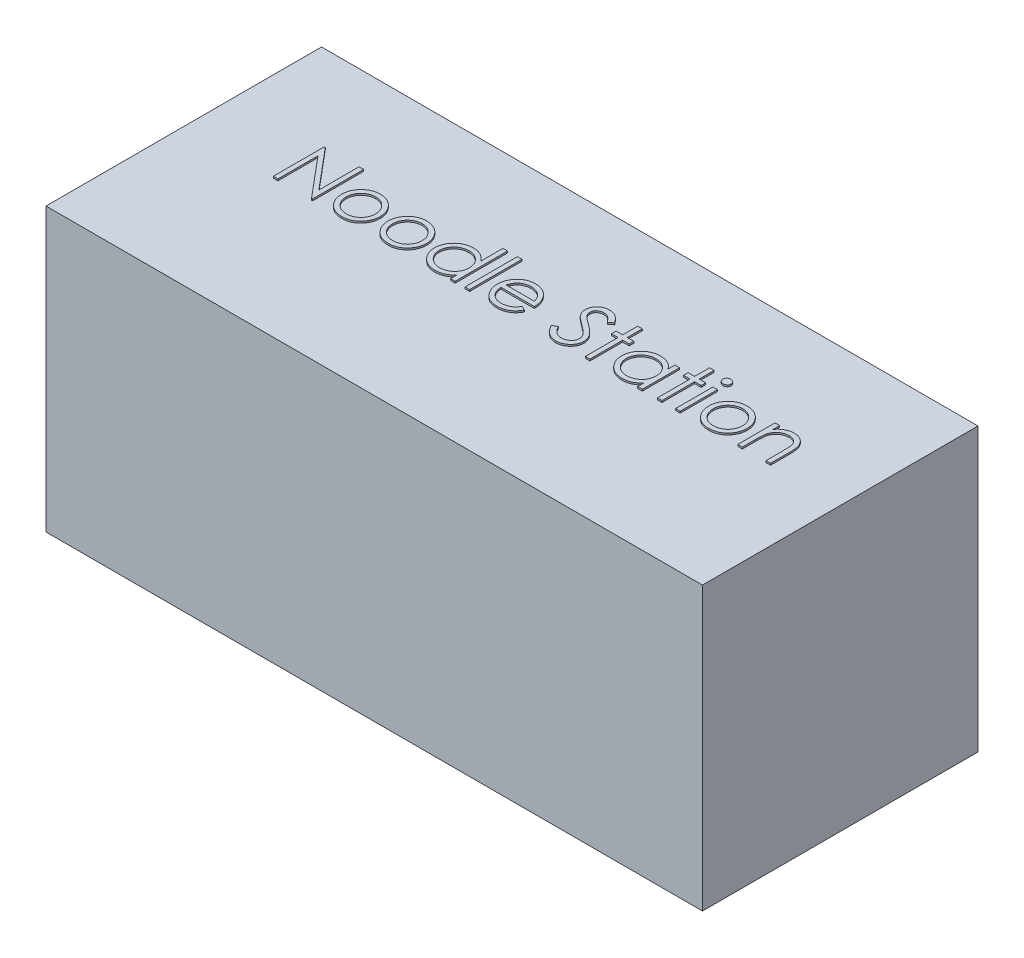
from build123d import *

# Parameters (mm, degrees)
SKETCH1_W           = 1930
SKETCH1_H           = 810
BOSS_EXTRUDE1_DEPTH = 830
SKETCH2_W           = 13.461538461
SKETCH2_H           = 153.846153846
SKETCH2_H_2         = 109.615384615
BOSS_EXTRUDE2_DEPTH = 5


with BuildPart() as part:
    # Sketch1 → Boss-Extrude1 (new body)
    with BuildSketch(Plane(origin=(0, 0, 0), x_dir=(1, 0, 0), z_dir=(0, 1, 0))):
        Rectangle(SKETCH1_W, SKETCH1_H)
    extrude(amount=BOSS_EXTRUDE1_DEPTH)

    # Sketch2 → Boss-Extrude2 (add)
    # profile 1 of 14: a face of its own
    with BuildSketch(Plane(origin=(0, 830, 0), x_dir=(1, 0, 0), z_dir=(0, 1, 0))):
        Polygon((-701.623137804, 0), (-701.623137804, 150), (-698.798618573, 150), (-599.700060881, 31.941105769), (-599.700060881, 150), (-586.238522419, 150), (-586.238522419, 0), (-589.303426265, 0), (-688.161599342, 117.788461538), (-688.161599342, 0), align=None)
    # profile 2 of 14: a face of its own
    with BuildSketch(Plane(origin=(0, 830, 0), x_dir=(1, 0, 0), z_dir=(0, 1, 0))):
        with BuildLine():
            add(Edge.make_bspline(
                [(-498.678426265, 111.538461538), (-496.621657429, 111.494666204), (-492.58883639, 111.408794256), (-486.682784138, 110.491010014), (-481.045135456, 109.08755154), (-475.654298648, 107.147341737), (-470.579314558, 104.546686713), (-465.746261239, 101.443431379), (-461.168389429, 97.767034512), (-458.424545318, 94.923117296), (-457.03179165, 93.479567308)],
                knots=[0, 0, 0, 0, 1.054011418, 2.066658804, 3.057071809, 4.030435133, 4.997543892, 5.974964718, 6.972108034, 8, 8, 8, 8], degree=3))
            add(Edge.make_bspline(
                [(-457.03179165, 93.479567308), (-455.832565047, 92.098967917), (-453.45732018, 89.364487536), (-450.411646517, 84.930675552), (-447.787865368, 80.338956955), (-445.68516704, 75.528357241), (-444.027237453, 70.540871334), (-442.850136185, 65.35935657), (-442.149981831, 59.995255977), (-442.055568962, 56.352234346), (-442.007753188, 54.507211538)],
                knots=[0, 0, 0, 0, 1.025258237, 2.030674902, 3.01204498, 3.988269485, 4.97094183, 5.956517959, 6.965070386, 8, 8, 8, 8], degree=3))
            add(Edge.make_bspline(
                [(-442.007753188, 54.507211538), (-442.049810502, 52.651494781), (-442.132917715, 48.984511924), (-442.919072703, 43.583681962), (-444.141833527, 38.34676099), (-445.891769449, 33.295674114), (-448.135688417, 28.414981511), (-450.87386074, 23.726000827), (-454.125501475, 19.21948083), (-457.81138705, 14.933687762), (-461.885038885, 10.983707128), (-466.304302385, 7.541067004), (-470.982332403, 4.591573103), (-475.981333257, 2.215726719), (-481.255654122, 0.342453849), (-486.816671326, -0.973261141), (-492.655745768, -1.768761874), (-496.642626684, -1.870915014), (-498.678426265, -1.923076923)],
                knots=[0, 0, 0, 0, 0.998656419, 1.973391657, 2.932242238, 3.890759089, 4.846373663, 5.82037756, 6.809684879, 7.83454468, 8.860553229, 9.859544525, 10.845671541, 11.83227036, 12.833544569, 13.85385346, 14.904124723, 16, 16, 16, 16], degree=3))
            add(Edge.make_bspline(
                [(-498.678426265, -1.923076923), (-500.724199959, -1.870739942), (-504.73095109, -1.768235321), (-510.590636029, -0.976351776), (-516.161619698, 0.341847477), (-521.442845349, 2.22188288), (-526.46333879, 4.591649041), (-531.168474373, 7.532150022), (-535.591327895, 10.984728104), (-539.665841513, 14.93341112), (-543.351496027, 19.219552106), (-546.603196385, 23.725982327), (-549.34135322, 28.414986332), (-551.585276243, 33.295672829), (-553.335211083, 38.346761334), (-554.557972197, 43.583681868), (-555.344127107, 48.984511948), (-555.427234331, 52.651494789), (-555.46929165, 54.507211538)],
                knots=[0, 0, 0, 0, 1.099876186, 2.154163076, 3.173186993, 4.173200201, 5.163417411, 6.152872554, 7.150605724, 8.17532212, 9.198891216, 10.186952605, 11.159729845, 12.11414092, 13.071450619, 14.029093627, 15.002601286, 16, 16, 16, 16], degree=3))
            add(Edge.make_bspline(
                [(-555.46929165, 54.507211538), (-555.421149778, 56.342206362), (-555.325837144, 59.975180751), (-554.626386755, 65.329197636), (-553.453877192, 70.501942882), (-551.793960201, 75.470177567), (-549.671880591, 80.259696255), (-547.084968251, 84.86276044), (-544.008226856, 89.276523317), (-541.642428933, 92.007469604), (-540.445253188, 93.389423077)],
                knots=[0, 0, 0, 0, 1.031353054, 2.041901799, 3.029428768, 4.008703097, 4.981709435, 5.96992636, 6.972712378, 8, 8, 8, 8], degree=3))
            add(Edge.make_bspline(
                [(-540.445253188, 93.389423077), (-539.054599287, 94.845491902), (-536.319633694, 97.709107454), (-531.718973934, 101.374787058), (-526.897810172, 104.542618795), (-521.766741909, 107.091599457), (-516.380333711, 109.098964502), (-510.713794745, 110.494629436), (-504.787701226, 111.405487506), (-500.735146036, 111.493695126), (-498.678426265, 111.538461538)],
                knots=[0, 0, 0, 0, 1.027980169, 2.021703884, 2.998553061, 3.971491411, 4.943284454, 5.930300938, 6.949603206, 8, 8, 8, 8], degree=3))
        make_face()
        with BuildLine():
            add(Edge.make_bspline(
                [(-498.738522419, 98.076923077), (-500.192991476, 98.035583434), (-503.064382704, 97.953971324), (-507.290936335, 97.33323255), (-511.359800075, 96.34976809), (-515.278693395, 94.952451393), (-519.034400784, 93.148212869), (-522.63051803, 90.932140289), (-526.077622597, 88.333585011), (-529.308282456, 85.35661337), (-532.273238691, 82.104656462), (-534.865151974, 78.639726795), (-537.069085104, 75.01802624), (-538.905091916, 71.23578862), (-540.272542834, 67.254685167), (-541.265672369, 63.119800972), (-541.885825532, 58.822711694), (-541.966670328, 55.901525195), (-542.007753188, 54.417067308)],
                knots=[0, 0, 0, 0, 1.021534396, 2.016698045, 2.994645724, 3.958388632, 4.93408049, 5.916473867, 6.921342795, 7.962252576, 8.998418191, 10.008913653, 10.997312074, 11.973003931, 12.956656626, 13.948281152, 14.957379055, 16, 16, 16, 16], degree=3))
            add(Edge.make_bspline(
                [(-542.007753188, 54.417067308), (-541.938889318, 52.499123287), (-541.802207413, 48.69236305), (-540.69069728, 43.08617208), (-538.831285285, 37.704092703), (-536.320401869, 32.577676159), (-533.174421069, 27.834578529), (-529.467832497, 23.605800628), (-525.240416767, 19.954980137), (-520.542566759, 16.925801042), (-515.470238848, 14.518954369), (-510.102110801, 12.813283981), (-504.503223913, 11.704497164), (-500.676906864, 11.59429112), (-498.738522419, 11.538461538)],
                knots=[0, 0, 0, 0, 1.016792936, 2.018143844, 3.017858371, 4.030088057, 5.03801393, 6.028138512, 7.003788237, 7.991172063, 8.984598303, 9.972568034, 10.972917682, 12, 12, 12, 12], degree=3))
            add(Edge.make_bspline(
                [(-498.738522419, 11.538461538), (-496.800249465, 11.594616407), (-492.974152494, 11.705464558), (-487.383044916, 12.807699689), (-482.029588979, 14.526428005), (-476.962529514, 16.923094142), (-472.266817938, 19.966483347), (-468.008998453, 23.585185221), (-464.334057975, 27.845778851), (-461.191189194, 32.583958657), (-458.639185935, 37.696145176), (-456.788477286, 43.087165417), (-455.674295034, 48.692110071), (-455.537973803, 52.499038531), (-455.46929165, 54.417067308)],
                knots=[0, 0, 0, 0, 1.02726834, 2.027799167, 3.010890988, 4.004497153, 4.992059811, 5.971914811, 6.958719428, 7.966827853, 8.981595046, 9.981490638, 10.983022906, 12, 12, 12, 12], degree=3))
            add(Edge.make_bspline(
                [(-455.46929165, 54.417067308), (-455.510360365, 55.901534067), (-455.591177327, 58.822738024), (-456.211532944, 63.11970032), (-457.203913215, 67.255054462), (-458.574125383, 71.234426031), (-460.402154548, 75.027819073), (-462.648588537, 78.62909309), (-465.229918197, 82.116659349), (-468.23065195, 85.346101098), (-471.457939574, 88.334745522), (-474.90644121, 90.933147925), (-478.497226006, 93.138473446), (-482.242022406, 94.967883756), (-486.161418163, 96.337055485), (-490.224580842, 97.338911121), (-494.433101268, 97.951348119), (-497.294203117, 98.034797039), (-498.738522419, 98.076923077)],
                knots=[0, 0, 0, 0, 1.042956736, 2.052379634, 3.044323526, 4.02829302, 5.004299113, 5.996692471, 7.007513377, 8.048758398, 9.090003419, 10.095195979, 11.07790575, 12.047570684, 13.018257071, 13.989683339, 14.985167495, 16, 16, 16, 16], degree=3))
        make_face(mode=Mode.SUBTRACT)
    # profile 3 of 14: a face of its own
    with BuildSketch(Plane(origin=(0, 830, 0), x_dir=(1, 0, 0), z_dir=(0, 1, 0))):
        with BuildLine():
            add(Edge.make_bspline(
                [(-362.139964727, 111.538461538), (-360.083195891, 111.494666204), (-356.050374852, 111.408794256), (-350.1443226, 110.491010014), (-344.506673917, 109.08755154), (-339.11583711, 107.147341737), (-334.040853019, 104.546686713), (-329.2077997, 101.443431379), (-324.629927891, 97.767034512), (-321.88608378, 94.923117296), (-320.493330111, 93.479567308)],
                knots=[0, 0, 0, 0, 1.054011418, 2.066658804, 3.057071809, 4.030435133, 4.997543892, 5.974964718, 6.972108034, 8, 8, 8, 8], degree=3))
            add(Edge.make_bspline(
                [(-320.493330111, 93.479567308), (-319.294103509, 92.098967917), (-316.918858641, 89.364487536), (-313.873184979, 84.930675552), (-311.249403829, 80.338956955), (-309.146705501, 75.528357241), (-307.488775915, 70.540871334), (-306.311674647, 65.35935657), (-305.611520292, 59.995255977), (-305.517107423, 56.352234346), (-305.46929165, 54.507211538)],
                knots=[0, 0, 0, 0, 1.025258237, 2.030674902, 3.01204498, 3.988269485, 4.97094183, 5.956517959, 6.965070386, 8, 8, 8, 8], degree=3))
            add(Edge.make_bspline(
                [(-305.46929165, 54.507211538), (-305.511348964, 52.651494781), (-305.594456177, 48.984511924), (-306.380611165, 43.583681962), (-307.603371988, 38.34676099), (-309.35330791, 33.295674114), (-311.597226879, 28.414981511), (-314.335399201, 23.726000827), (-317.587039936, 19.21948083), (-321.272925512, 14.933687762), (-325.346577347, 10.983707128), (-329.765840846, 7.541067004), (-334.443870864, 4.591573103), (-339.442871719, 2.215726719), (-344.717192583, 0.342453849), (-350.278209788, -0.973261141), (-356.11728423, -1.768761874), (-360.104165145, -1.870915014), (-362.139964727, -1.923076923)],
                knots=[0, 0, 0, 0, 0.998656419, 1.973391657, 2.932242238, 3.890759089, 4.846373663, 5.82037756, 6.809684879, 7.83454468, 8.860553229, 9.859544525, 10.845671541, 11.83227036, 12.833544569, 13.85385346, 14.904124723, 16, 16, 16, 16], degree=3))
            add(Edge.make_bspline(
                [(-362.139964727, -1.923076923), (-364.18573842, -1.870739942), (-368.192489551, -1.768235321), (-374.052174491, -0.976351776), (-379.623158159, 0.341847477), (-384.90438381, 2.22188288), (-389.924877251, 4.591649041), (-394.630012835, 7.532150022), (-399.052866357, 10.984728104), (-403.127379975, 14.93341112), (-406.813034489, 19.219552106), (-410.064734846, 23.725982327), (-412.802891681, 28.414986332), (-415.046814705, 33.295672829), (-416.796749544, 38.346761334), (-418.019510659, 43.583681868), (-418.805665569, 48.984511948), (-418.888772792, 52.651494789), (-418.930830111, 54.507211538)],
                knots=[0, 0, 0, 0, 1.099876186, 2.154163076, 3.173186993, 4.173200201, 5.163417411, 6.152872554, 7.150605724, 8.17532212, 9.198891216, 10.186952605, 11.159729845, 12.11414092, 13.071450619, 14.029093627, 15.002601286, 16, 16, 16, 16], degree=3))
            add(Edge.make_bspline(
                [(-418.930830111, 54.507211538), (-418.882688239, 56.342206362), (-418.787375606, 59.975180751), (-418.087925217, 65.329197636), (-416.915415653, 70.501942882), (-415.255498662, 75.470177567), (-413.133419053, 80.259696255), (-410.546506712, 84.86276044), (-407.469765318, 89.276523317), (-405.103967395, 92.007469604), (-403.90679165, 93.389423077)],
                knots=[0, 0, 0, 0, 1.031353054, 2.041901799, 3.029428768, 4.008703097, 4.981709435, 5.96992636, 6.972712378, 8, 8, 8, 8], degree=3))
            add(Edge.make_bspline(
                [(-403.90679165, 93.389423077), (-402.516137749, 94.845491902), (-399.781172155, 97.709107454), (-395.180512395, 101.374787058), (-390.359348634, 104.542618795), (-385.228280371, 107.091599457), (-379.841872172, 109.098964502), (-374.175333207, 110.494629436), (-368.249239687, 111.405487506), (-364.196684497, 111.493695126), (-362.139964727, 111.538461538)],
                knots=[0, 0, 0, 0, 1.027980169, 2.021703884, 2.998553061, 3.971491411, 4.943284454, 5.930300938, 6.949603206, 8, 8, 8, 8], degree=3))
        make_face()
        with BuildLine():
            add(Edge.make_bspline(
                [(-362.200060881, 98.076923077), (-363.654529937, 98.035583434), (-366.525921166, 97.953971324), (-370.752474796, 97.33323255), (-374.821338536, 96.34976809), (-378.740231856, 94.952451393), (-382.495939245, 93.148212869), (-386.092056491, 90.932140289), (-389.539161059, 88.333585011), (-392.769820917, 85.35661337), (-395.734777153, 82.104656462), (-398.326690435, 78.639726795), (-400.530623566, 75.01802624), (-402.366630377, 71.23578862), (-403.734081296, 67.254685167), (-404.727210831, 63.119800972), (-405.347363993, 58.822711694), (-405.42820879, 55.901525195), (-405.46929165, 54.417067308)],
                knots=[0, 0, 0, 0, 1.021534396, 2.016698045, 2.994645724, 3.958388632, 4.93408049, 5.916473867, 6.921342795, 7.962252576, 8.998418191, 10.008913653, 10.997312074, 11.973003931, 12.956656626, 13.948281152, 14.957379055, 16, 16, 16, 16], degree=3))
            add(Edge.make_bspline(
                [(-405.46929165, 54.417067308), (-405.40042778, 52.499123287), (-405.263745875, 48.69236305), (-404.152235742, 43.08617208), (-402.292823747, 37.704092703), (-399.781940331, 32.577676159), (-396.63595953, 27.834578529), (-392.929370958, 23.605800628), (-388.701955229, 19.954980137), (-384.00410522, 16.925801042), (-378.93177731, 14.518954369), (-373.563649262, 12.813283981), (-367.964762375, 11.704497164), (-364.138445325, 11.59429112), (-362.200060881, 11.538461538)],
                knots=[0, 0, 0, 0, 1.016792936, 2.018143844, 3.017858371, 4.030088057, 5.03801393, 6.028138512, 7.003788237, 7.991172063, 8.984598303, 9.972568034, 10.972917682, 12, 12, 12, 12], degree=3))
            add(Edge.make_bspline(
                [(-362.200060881, 11.538461538), (-360.261787926, 11.594616407), (-356.435690956, 11.705464558), (-350.844583377, 12.807699689), (-345.49112744, 14.526428005), (-340.424067975, 16.923094142), (-335.728356399, 19.966483347), (-331.470536914, 23.585185221), (-327.795596437, 27.845778851), (-324.652727655, 32.583958657), (-322.100724396, 37.696145176), (-320.250015748, 43.087165417), (-319.135833496, 48.692110071), (-318.999512265, 52.499038531), (-318.930830111, 54.417067308)],
                knots=[0, 0, 0, 0, 1.02726834, 2.027799167, 3.010890988, 4.004497153, 4.992059811, 5.971914811, 6.958719428, 7.966827853, 8.981595046, 9.981490638, 10.983022906, 12, 12, 12, 12], degree=3))
            add(Edge.make_bspline(
                [(-318.930830111, 54.417067308), (-318.971898827, 55.901534067), (-319.052715789, 58.822738024), (-319.673071405, 63.11970032), (-320.665451677, 67.255054462), (-322.035663845, 71.234426031), (-323.86369301, 75.027819073), (-326.110126999, 78.62909309), (-328.691456659, 82.116659349), (-331.692190412, 85.346101098), (-334.919478035, 88.334745522), (-338.367979672, 90.933147925), (-341.958764468, 93.138473446), (-345.703560868, 94.967883756), (-349.622956624, 96.337055485), (-353.686119303, 97.338911121), (-357.894639729, 97.951348119), (-360.755741579, 98.034797039), (-362.200060881, 98.076923077)],
                knots=[0, 0, 0, 0, 1.042956736, 2.052379634, 3.044323526, 4.02829302, 5.004299113, 5.996692471, 7.007513377, 8.048758398, 9.090003419, 10.095195979, 11.07790575, 12.047570684, 13.018257071, 13.989683339, 14.985167495, 16, 16, 16, 16], degree=3))
        make_face(mode=Mode.SUBTRACT)
    # profile 4 of 14: a face of its own
    with BuildSketch(Plane(origin=(0, 830, 0), x_dir=(1, 0, 0), z_dir=(0, 1, 0))):
        with BuildLine():
            Line((-167.007753188, 153.846153846), (-167.007753188, 0))
            Line((-167.007753188, 0), (-180.46929165, 0))
            Line((-180.46929165, 0), (-180.46929165, 18.960336538))
            add(Edge.make_bspline(
                [(-180.46929165, 18.960336538), (-181.98723982, 17.24435394), (-184.94953476, 13.895592322), (-189.897011245, 9.520642073), (-195.141361726, 5.904428292), (-200.657132632, 2.983717619), (-206.439343061, 0.789772348), (-212.475175373, -0.769634472), (-218.767091696, -1.772227408), (-223.063621187, -1.872342631), (-225.240926265, -1.923076923)],
                knots=[0, 0, 0, 0, 1.074387032, 2.096679803, 3.090159297, 4.057316773, 5.018401886, 5.985159533, 6.978961417, 8, 8, 8, 8], degree=3))
            add(Edge.make_bspline(
                [(-225.240926265, -1.923076923), (-227.176695715, -1.870518112), (-230.994118782, -1.766869808), (-236.609650659, -0.962771082), (-242.013604207, 0.328541275), (-247.211085893, 2.124293681), (-252.168463554, 4.506328894), (-256.928181983, 7.358096668), (-261.46558307, 10.754132243), (-265.711506168, 14.636476315), (-269.621449041, 18.853404337), (-273.052646439, 23.351070632), (-275.913492719, 28.110026513), (-278.305781892, 33.070018822), (-280.148482368, 38.269229659), (-281.433066693, 43.689679714), (-282.236228695, 49.324960009), (-282.339834153, 53.162368141), (-282.392368573, 55.108173077)],
                knots=[0, 0, 0, 0, 1.033919861, 2.038935746, 3.024066025, 3.998881131, 4.97069526, 5.957263378, 6.95902576, 7.993208707, 9.027059324, 10.027763471, 11.009749337, 11.988697705, 12.965288445, 13.950418724, 14.960734635, 16, 16, 16, 16], degree=3))
            add(Edge.make_bspline(
                [(-282.392368573, 55.108173077), (-282.338669799, 57.013760373), (-282.232510221, 60.781003658), (-281.441657942, 66.321519286), (-280.111757571, 71.658016174), (-278.245421242, 76.773313741), (-275.852194601, 81.673601605), (-272.940990871, 86.362345534), (-269.511599813, 90.852462568), (-265.557925227, 95.038372289), (-261.275006505, 98.904970043), (-256.693203752, 102.265357705), (-251.926491695, 105.167508369), (-246.900934101, 107.466943067), (-241.690915324, 109.327333262), (-236.250053363, 110.614460466), (-230.600985705, 111.372917091), (-226.765678903, 111.48274984), (-224.820253188, 111.538461538)],
                knots=[0, 0, 0, 0, 1.020392517, 2.01726096, 2.990465484, 3.961182959, 4.928053699, 5.906110375, 6.912531644, 7.948652711, 8.985773172, 9.998621852, 10.987621588, 11.969261332, 12.953316658, 13.946091881, 14.958173133, 16, 16, 16, 16], degree=3))
            add(Edge.make_bspline(
                [(-224.820253188, 111.538461538), (-222.58239, 111.47130028), (-218.189713258, 111.339470193), (-211.765490907, 110.23776875), (-205.688879026, 108.387931129), (-199.924893849, 105.855447645), (-194.507898411, 102.563986875), (-189.398185243, 98.588924825), (-184.684614261, 93.817761421), (-181.895821867, 90.234408273), (-180.46929165, 88.401442308)],
                knots=[0, 0, 0, 0, 1.031072012, 2.023879775, 2.993683497, 3.952812103, 4.918022106, 5.908088563, 6.929940113, 8, 8, 8, 8], degree=3))
            Line((-180.46929165, 88.401442308), (-180.46929165, 153.846153846))
            Line((-180.46929165, 153.846153846), (-167.007753188, 153.846153846))
        make_face()
        with BuildLine():
            add(Edge.make_bspline(
                [(-224.639964727, 98.076923077), (-226.607722064, 98.006910031), (-230.491762063, 97.868715415), (-236.193647866, 96.789851336), (-241.649937041, 94.994797292), (-246.833340224, 92.53985867), (-251.661978079, 89.452912815), (-255.977421115, 85.719139246), (-259.814965458, 81.440410068), (-263.042462497, 76.636033908), (-265.673483793, 71.485544291), (-267.523499448, 66.101639801), (-268.743610051, 60.581426477), (-268.868260932, 56.837311372), (-268.930830111, 54.957932692)],
                knots=[0, 0, 0, 0, 1.031046209, 2.035121221, 3.029706178, 4.034933723, 5.034054252, 6.02443088, 7.017295772, 8.038157696, 9.050218397, 10.03989886, 11.016116709, 12, 12, 12, 12], degree=3))
            add(Edge.make_bspline(
                [(-268.930830111, 54.957932692), (-268.850906112, 53.089785242), (-268.69137139, 49.360812847), (-267.544913058, 43.833073843), (-265.621489911, 38.447900612), (-262.99683008, 33.251000889), (-259.710260449, 28.425968017), (-255.900746768, 24.06567705), (-251.531448997, 20.316123267), (-246.691698694, 17.177370112), (-241.522785677, 14.641833502), (-236.087045757, 12.877591809), (-230.486661264, 11.738544068), (-226.678704099, 11.605495061), (-224.760157035, 11.538461538)],
                knots=[0, 0, 0, 0, 0.979072187, 1.954306742, 2.945804271, 3.96968567, 4.997920485, 5.998718438, 6.996577872, 8.005894225, 9.015743152, 10.005417472, 10.995077863, 12, 12, 12, 12], degree=3))
            add(Edge.make_bspline(
                [(-224.760157035, 11.538461538), (-222.812449773, 11.60960285), (-218.938653208, 11.751095861), (-213.219851442, 12.83457866), (-207.670067322, 14.624670018), (-202.364900391, 17.106061163), (-197.422780485, 20.181376416), (-192.987157159, 23.781680317), (-189.2364728, 27.968959637), (-186.056789532, 32.570807625), (-183.563557388, 37.615607473), (-181.747440565, 42.987072791), (-180.673701746, 48.685390568), (-180.538370476, 52.579558866), (-180.46929165, 54.567307692)],
                knots=[0, 0, 0, 0, 1.01762866, 2.023962475, 3.030623092, 4.058876274, 5.077231937, 6.066672613, 7.034107872, 8.005628644, 8.981990164, 9.965428785, 10.961468474, 12, 12, 12, 12], degree=3))
            add(Edge.make_bspline(
                [(-180.46929165, 54.567307692), (-180.51041978, 56.081786143), (-180.591372956, 59.062759001), (-181.209825936, 63.439652611), (-182.193608496, 67.628240869), (-183.579872925, 71.632927543), (-185.400927972, 75.43157106), (-187.597260795, 79.051446498), (-190.207494355, 82.473726986), (-193.189609903, 85.65128717), (-196.453832869, 88.549564124), (-199.90788461, 91.136603012), (-203.592688051, 93.261836129), (-207.446275348, 95.020747765), (-211.475332539, 96.420425618), (-215.712644817, 97.354183922), (-220.113172828, 97.995340538), (-223.115146631, 98.049442571), (-224.639964727, 98.076923077)],
                knots=[0, 0, 0, 0, 1.050140795, 2.067009409, 3.05949893, 4.030605086, 5.00011959, 5.97591094, 6.962425594, 7.979863591, 8.993523472, 9.986985069, 10.967611495, 11.937549037, 12.921786183, 13.919465291, 14.943216303, 16, 16, 16, 16], degree=3))
        make_face(mode=Mode.SUBTRACT)
    # profile 5 of 14: a face of its own
    with BuildSketch(Plane(origin=(0, 830, 0), x_dir=(1, 0, 0), z_dir=(0, 1, 0))):
        with Locations((-131.430830112, 76.923076923)):
            Rectangle(SKETCH2_W, SKETCH2_H)
    # profile 6 of 14: a face of its own
    with BuildSketch(Plane(origin=(0, 830, 0), x_dir=(1, 0, 0), z_dir=(0, 1, 0))):
        with BuildLine():
            Line((-3.966887804, 34.615384615), (7.992246812, 28.335336538))
            add(Edge.make_bspline(
                [(7.992246812, 28.335336538), (7.039249873, 26.644908055), (5.185095223, 23.356003649), (1.996491742, 18.837495343), (-1.346025654, 14.772593235), (-4.993338568, 11.269893766), (-8.836324809, 8.216262982), (-12.896295729, 5.544641922), (-17.194387917, 3.268133907), (-21.730804693, 1.350168427), (-26.543642599, -0.124524178), (-31.644564731, -1.166133646), (-37.043343105, -1.809988016), (-40.74389367, -1.884779764), (-42.638762804, -1.923076923)],
                knots=[0, 0, 0, 0, 1.120438281, 2.179929193, 3.190490725, 4.156257408, 5.095198341, 6.022838206, 6.959905092, 7.901321166, 8.864066838, 9.862729781, 10.905609505, 12, 12, 12, 12], degree=3))
            add(Edge.make_bspline(
                [(-42.638762804, -1.923076923), (-44.744847555, -1.873912266), (-48.853208769, -1.778006263), (-54.833483645, -0.951186359), (-60.464030148, 0.397629014), (-65.74453172, 2.281866506), (-70.662056831, 4.743037538), (-75.22637918, 7.741301044), (-79.461501717, 11.261254817), (-83.233967825, 15.333388109), (-86.630134227, 19.691186279), (-89.626955083, 24.232152757), (-92.132273557, 28.944862377), (-94.170242565, 33.799313407), (-95.81616535, 38.764908845), (-96.963309797, 43.886828884), (-97.62458471, 49.151211065), (-97.72591809, 52.712525453), (-97.776983958, 54.507211538)],
                knots=[0, 0, 0, 0, 1.145258523, 2.234067595, 3.276747158, 4.290159414, 5.277019952, 6.260822364, 7.254936242, 8.264827045, 9.274100331, 10.257902744, 11.220704747, 12.172965371, 13.118907548, 14.062713208, 15.023725156, 16, 16, 16, 16], degree=3))
            add(Edge.make_bspline(
                [(-97.776983958, 54.507211538), (-97.731592186, 56.191275699), (-97.64163169, 59.528868472), (-97.074597944, 64.46882038), (-96.069671099, 69.270039774), (-94.690685787, 73.936516116), (-92.909918093, 78.460436143), (-90.731394412, 82.844553156), (-88.151721079, 87.084202007), (-86.16003506, 89.758622023), (-85.15679165, 91.105769231)],
                knots=[0, 0, 0, 0, 1.024358464, 2.0301432, 3.019427413, 4.004406732, 4.986367066, 5.972626655, 6.978780325, 8, 8, 8, 8], degree=3))
            add(Edge.make_bspline(
                [(-85.15679165, 91.105769231), (-83.79789096, 92.728720806), (-81.123136105, 95.923212968), (-76.599292304, 100.120569787), (-71.700712461, 103.636731581), (-66.488785628, 106.551323129), (-60.90293674, 108.765908001), (-55.018252838, 110.416232953), (-48.767727714, 111.341004855), (-44.494646821, 111.471626296), (-42.308233958, 111.538461538)],
                knots=[0, 0, 0, 0, 1.030682036, 2.02871468, 2.997146059, 3.962720338, 4.930598197, 5.918074684, 6.934738563, 8, 8, 8, 8], degree=3))
            add(Edge.make_bspline(
                [(-42.308233958, 111.538461538), (-40.060479445, 111.480430872), (-35.650897476, 111.366587932), (-29.220949431, 110.311173643), (-23.136918722, 108.637492733), (-17.401239966, 106.273758854), (-12.013331648, 103.224063778), (-7.008215238, 99.446556286), (-2.300293272, 95.05720969), (0.438645822, 91.681643572), (1.832391042, 89.963942308)],
                knots=[0, 0, 0, 0, 1.056321875, 2.072262726, 3.055038591, 4.01806755, 4.982017516, 5.957941055, 6.960871419, 8, 8, 8, 8], degree=3))
            add(Edge.make_bspline(
                [(1.832391042, 89.963942308), (2.780688399, 88.669503105), (4.67097096, 86.089240876), (7.038703819, 81.881905572), (9.094020746, 77.480022957), (10.736861933, 72.812438796), (12.06712627, 67.934456788), (13.029561359, 62.811204872), (13.593973584, 57.444208671), (13.704917756, 53.787356293), (13.761477581, 51.923076923)],
                knots=[0, 0, 0, 0, 0.94817472, 1.890038105, 2.849395472, 3.817997239, 4.812318967, 5.836947057, 6.897266129, 8, 8, 8, 8], degree=3))
            Line((13.761477581, 51.923076923), (-84.315445496, 51.923076923))
            add(Edge.make_bspline(
                [(-84.315445496, 51.923076923), (-84.249462363, 50.478771312), (-84.119709194, 47.63860258), (-83.514774487, 43.482711877), (-82.561255611, 39.523854356), (-81.221152927, 35.791723985), (-79.59828813, 32.237575663), (-77.610328839, 28.887774079), (-75.23863367, 25.757577077), (-72.593246553, 22.818985466), (-69.648656753, 20.202095701), (-66.550824729, 17.85987672), (-63.25538623, 15.896779717), (-59.788325509, 14.30335587), (-56.155249002, 13.055942325), (-52.355012069, 12.204464296), (-48.395092797, 11.634159715), (-45.695704195, 11.570745493), (-44.321455111, 11.538461538)],
                knots=[0, 0, 0, 0, 1.094153842, 2.151609401, 3.174256925, 4.172055639, 5.149267565, 6.128595816, 7.11444997, 8.118368179, 9.117203808, 10.09244225, 11.054858984, 12.015122123, 12.976791628, 13.957293641, 14.960065497, 16, 16, 16, 16], degree=3))
            add(Edge.make_bspline(
                [(-44.321455111, 11.538461538), (-42.9778345, 11.56452111), (-40.31183346, 11.616228298), (-36.341511003, 12.11902448), (-32.435531257, 12.932036292), (-28.610060545, 14.041607296), (-24.942738578, 15.394900957), (-21.546500718, 17.027880571), (-18.423062905, 18.834298288), (-15.503764337, 20.900427219), (-12.672150336, 23.429349519), (-9.863186633, 26.585166133), (-6.85133006, 30.317488752), (-4.9660618, 33.126588723), (-3.966887804, 34.615384615)],
                knots=[0, 0, 0, 0, 0.99110716, 1.966546729, 2.947904876, 3.932708344, 4.903319531, 5.828989031, 6.710028674, 7.56322171, 8.463672341, 9.504779593, 10.677557249, 12, 12, 12, 12], degree=3))
        make_face()
        with BuildLine():
            add(Edge.make_bspline(
                [(0.299939119, 65.384615385), (-0.192773362, 67.170167116), (-1.141086282, 70.606779426), (-3.122644759, 75.365674731), (-5.354282217, 79.595156203), (-7.995213562, 83.262854762), (-10.98744466, 86.520148176), (-14.443666773, 89.366658969), (-18.31949078, 91.913121157), (-22.594882524, 94.062513992), (-27.122387598, 95.892079365), (-31.862652968, 97.11887004), (-36.699415306, 97.959278996), (-39.970884721, 98.037540786), (-41.617128188, 98.076923077)],
                knots=[0, 0, 0, 0, 1.154881502, 2.222775134, 3.210006277, 4.132804581, 5.035138423, 5.962687519, 6.919655026, 7.923214229, 8.944639381, 9.960483929, 10.97369054, 12, 12, 12, 12], degree=3))
            add(Edge.make_bspline(
                [(-41.617128188, 98.076923077), (-42.960675553, 98.050708582), (-45.616586227, 97.998888037), (-49.52948915, 97.507311066), (-53.287190532, 96.694746286), (-56.917417144, 95.581962431), (-60.372597217, 94.09873661), (-63.723801569, 92.359455469), (-66.885818551, 90.236244735), (-68.863302643, 88.618008099), (-69.862320496, 87.800480769)],
                knots=[0, 0, 0, 0, 1.04873581, 2.073130211, 3.073294108, 4.04793562, 5.032784715, 6.005352987, 6.992311501, 8, 8, 8, 8], degree=3))
            add(Edge.make_bspline(
                [(-69.862320496, 87.800480769), (-70.577746866, 87.153581528), (-72.025595476, 85.844415126), (-73.960189254, 83.588877702), (-75.812495226, 81.156667895), (-77.498223201, 78.454733984), (-79.044405478, 75.513843455), (-80.491261643, 72.358801945), (-81.793536446, 68.965667791), (-82.526226876, 66.601134681), (-82.903185881, 65.384615385)],
                knots=[0, 0, 0, 0, 0.879870761, 1.780643979, 2.707998968, 3.669668524, 4.684282772, 5.740141944, 6.837334558, 8, 8, 8, 8], degree=3))
            Line((-82.903185881, 65.384615385), (0.299939119, 65.384615385))
        make_face(mode=Mode.SUBTRACT)
    # profile 7 of 14: a face of its own
    with BuildSketch(Plane(origin=(0, 830, 0), x_dir=(1, 0, 0), z_dir=(0, 1, 0))):
        with BuildLine():
            Line((86.838400658, 28.936298077), (99.518689119, 36.538461538))
            add(Edge.make_bspline(
                [(99.518689119, 36.538461538), (100.698042144, 34.564273612), (102.957637028, 30.78180573), (106.726980992, 25.670746855), (110.632677185, 21.326654422), (114.703648623, 17.774799813), (118.915046399, 14.978418953), (123.294362988, 12.998323308), (127.82684059, 11.763352935), (130.911432939, 11.613349225), (132.451381427, 11.538461538)],
                knots=[0, 0, 0, 0, 1.272034388, 2.437168799, 3.508375237, 4.49857839, 5.41946034, 6.295179144, 7.148887113, 8, 8, 8, 8], degree=3))
            add(Edge.make_bspline(
                [(132.451381427, 11.538461538), (133.766532592, 11.57509036), (136.373822865, 11.647707086), (140.212204706, 12.345455745), (143.939996232, 13.417404127), (147.480366421, 14.952586906), (150.784464186, 16.80995058), (153.681893986, 19.053358188), (156.186727408, 21.565052718), (158.235689461, 24.367166489), (159.807690974, 27.380758572), (161.015922477, 30.474013629), (161.686425634, 33.695523698), (161.787429353, 35.864543534), (161.838400658, 36.959134615)],
                knots=[0, 0, 0, 0, 1.095163259, 2.171163733, 3.241058638, 4.321873601, 5.38011039, 6.391990106, 7.366004449, 8.327778327, 9.272591725, 10.192022065, 11.087607919, 12, 12, 12, 12], degree=3))
            add(Edge.make_bspline(
                [(161.838400658, 36.959134615), (161.775215914, 38.208028174), (161.646770562, 40.746846281), (160.561135701, 44.492545693), (158.853310837, 48.199370123), (157.277768963, 50.492281505), (156.459794889, 51.682692308)],
                knots=[0, 0, 0, 0, 0.938893495, 1.908633276, 2.914225137, 4, 4, 4, 4], degree=3))
            add(Edge.make_bspline(
                [(156.459794889, 51.682692308), (155.788197138, 52.541841891), (154.378261668, 54.345518972), (151.954368272, 57.030314778), (149.11010623, 59.799675591), (145.942811019, 62.75934946), (142.337107212, 65.771683604), (138.405928023, 68.980324087), (134.048905496, 72.263248817), (130.993212784, 74.464930198), (129.416525658, 75.600961538)],
                knots=[0, 0, 0, 0, 0.722233717, 1.516239348, 2.393582979, 3.351407094, 4.387010283, 5.505090956, 6.712668013, 8, 8, 8, 8], degree=3))
            add(Edge.make_bspline(
                [(129.416525658, 75.600961538), (127.838354393, 76.725043865), (124.821011111, 78.874203675), (120.601357582, 82.063815848), (116.828023453, 84.979981685), (113.517779888, 87.650153632), (110.67208288, 90.074693835), (108.268508122, 92.230319798), (106.368284247, 94.17532955), (105.311616504, 95.437101339), (104.837198735, 96.003605769)],
                knots=[0, 0, 0, 0, 1.452282411, 2.77665338, 3.964542531, 5.026858415, 5.96415736, 6.766646006, 7.446254459, 8, 8, 8, 8], degree=3))
            add(Edge.make_bspline(
                [(104.837198735, 96.003605769), (104.174089653, 96.886507349), (102.869996651, 98.622851796), (101.148596417, 101.336774272), (99.68548944, 104.114914218), (98.538532348, 106.964736985), (97.572694398, 109.846233937), (96.923068796, 112.79700161), (96.516294642, 115.803799544), (96.474638077, 117.827235285), (96.453785273, 118.840144231)],
                knots=[0, 0, 0, 0, 1.068054152, 2.10047183, 3.106115577, 4.101338837, 5.06977816, 6.043150881, 7.020423561, 8, 8, 8, 8], degree=3))
            add(Edge.make_bspline(
                [(96.453785273, 118.840144231), (96.509722801, 120.427134569), (96.620402233, 123.567194444), (97.556424401, 128.154230034), (99.033834129, 132.533647915), (101.103615038, 136.662090789), (103.771787306, 140.432061398), (106.859471921, 143.886925126), (110.537107046, 146.791292935), (114.572219471, 149.328952581), (118.988921132, 151.315206518), (123.617102706, 152.813534239), (128.464120079, 153.662502426), (131.747111563, 153.784335208), (133.412919889, 153.846153846)],
                knots=[0, 0, 0, 0, 1.005424448, 1.989358655, 2.955360095, 3.929531133, 4.905563448, 5.876582895, 6.856512386, 7.866279853, 8.892233794, 9.918561126, 10.94386622, 12, 12, 12, 12], degree=3))
            add(Edge.make_bspline(
                [(133.412919889, 153.846153846), (135.180524187, 153.785187349), (138.695724976, 153.663944445), (143.866405643, 152.609764531), (148.844722061, 150.865450026), (152.84943341, 148.885936113), (155.983694616, 146.908875439), (158.373954588, 145.108025827), (160.79613105, 143.034806887), (163.269761971, 140.683696341), (165.75293309, 138.033121294), (168.282509615, 135.101234626), (170.86440685, 131.905953661), (172.525372284, 129.624903628), (173.376862196, 128.455528846)],
                knots=[0, 0, 0, 0, 1.286793592, 2.559021753, 3.825965368, 5.121522368, 5.803751409, 6.523245864, 7.299691795, 8.125521123, 9.008227632, 9.944561021, 10.946284179, 12, 12, 12, 12], degree=3))
            Line((173.376862196, 128.455528846), (161.207391042, 119.230769231))
            add(Edge.make_bspline(
                [(161.207391042, 119.230769231), (160.472565365, 120.177427392), (159.057462919, 122.000469673), (156.909056339, 124.553526056), (154.884114286, 126.885660893), (152.889097152, 128.911309237), (151.029370089, 130.741400666), (149.224353993, 132.308247387), (147.500024654, 133.627201477), (145.326442769, 135.034782618), (142.595683413, 136.430061342), (139.167774717, 137.610736116), (135.585505787, 138.32023877), (133.145664437, 138.414048237), (131.910516042, 138.461538462)],
                knots=[0, 0, 0, 0, 1.181633172, 2.275549214, 3.290209073, 4.226197932, 5.078386478, 5.862611352, 6.581680152, 7.217281963, 8.414376989, 9.595101626, 10.782541182, 12, 12, 12, 12], degree=3))
            add(Edge.make_bspline(
                [(131.910516042, 138.461538462), (130.360950796, 138.409608464), (127.372760193, 138.309466355), (123.130321503, 137.215752699), (119.312010429, 135.493672972), (116.031186212, 133.080173911), (113.299601481, 130.220702795), (111.323653249, 126.930180435), (110.134360482, 123.296648895), (109.989234211, 120.762006481), (109.915323735, 119.471153846)],
                knots=[0, 0, 0, 0, 1.14458467, 2.207223713, 3.21896685, 4.227309161, 5.202851033, 6.127160689, 7.046193047, 8, 8, 8, 8], degree=3))
            add(Edge.make_bspline(
                [(109.915323735, 119.471153846), (109.932172019, 118.667519052), (109.965896138, 117.058935361), (110.43624461, 114.682445849), (111.040501566, 112.311959874), (111.998042926, 109.958134895), (113.31998451, 107.579805222), (115.05592062, 105.136016469), (117.242205422, 102.605228955), (118.916934523, 100.95919865), (119.801141042, 100.090144231)],
                knots=[0, 0, 0, 0, 0.858281714, 1.717966888, 2.583508476, 3.4729293, 4.427298488, 5.488583878, 6.674047936, 8, 8, 8, 8], degree=3))
            add(Edge.make_bspline(
                [(119.801141042, 100.090144231), (120.129485574, 99.797128839), (120.909557023, 99.100991339), (122.335668126, 97.961322168), (124.218930907, 96.55548907), (126.510168101, 94.81603265), (129.25162646, 92.798255702), (132.443607438, 90.527958038), (136.050530274, 87.931438366), (138.610040955, 86.116115197), (139.963400658, 85.15625)],
                knots=[0, 0, 0, 0, 0.420754252, 0.999615792, 1.744751191, 2.668019286, 3.750313428, 4.999500688, 6.413464383, 8, 8, 8, 8], degree=3))
            add(Edge.make_bspline(
                [(139.963400658, 85.15625), (141.591368371, 83.971620305), (144.743702216, 81.677749087), (149.229027069, 78.2313628), (153.295904559, 74.860744147), (156.958613283, 71.587418129), (160.253337931, 68.436214143), (163.14352596, 65.3692207), (165.658626546, 62.408410442), (168.366307337, 58.612442913), (171.133071031, 53.950396444), (173.509135635, 48.238471935), (175.007350526, 42.504343913), (175.203272616, 38.650336636), (175.299939119, 36.748798077)],
                knots=[0, 0, 0, 0, 1.163667725, 2.253281268, 3.268753668, 4.215851969, 5.092017293, 5.902905408, 6.650798638, 7.335211899, 8.59617414, 9.77448103, 10.901945474, 12, 12, 12, 12], degree=3))
            add(Edge.make_bspline(
                [(175.299939119, 36.748798077), (175.271776057, 35.404011001), (175.21599684, 32.740551707), (174.574814821, 28.82961984), (173.635400599, 25.031153997), (172.219519144, 21.392106321), (170.49138379, 17.845902205), (168.298544596, 14.485563616), (165.756786679, 11.236717963), (162.841053897, 8.185996905), (159.650515226, 5.385445648), (156.278356884, 2.894200156), (152.719059472, 0.816986297), (148.991931614, -0.878049791), (145.096117184, -2.203771971), (141.032926448, -3.164323505), (136.795661682, -3.753853973), (133.915641043, -3.81504375), (132.451381427, -3.846153846)],
                knots=[0, 0, 0, 0, 0.983748083, 1.948392443, 2.894712957, 3.844097841, 4.80183111, 5.778335162, 6.776009319, 7.81870978, 8.863265674, 9.881300176, 10.883814829, 11.87499822, 12.874611388, 13.892143829, 14.928324115, 16, 16, 16, 16], degree=3))
            add(Edge.make_bspline(
                [(132.451381427, -3.846153846), (131.318438156, -3.824246063), (129.066819868, -3.780706404), (125.736413502, -3.395794386), (122.473288251, -2.851204232), (119.31839045, -1.986601233), (116.231072808, -0.937587931), (113.224762757, 0.354054895), (110.298003306, 1.901934957), (107.434392611, 3.671721726), (104.6412137, 5.731339351), (101.944665075, 8.130203484), (99.25627141, 10.802153698), (96.655382996, 13.81974927), (94.089391098, 17.134238536), (91.608887832, 20.77663211), (89.162528503, 24.727090128), (87.627579881, 27.507022373), (86.838400658, 28.936298077)],
                knots=[0, 0, 0, 0, 0.915332311, 1.819136955, 2.706846663, 3.586547465, 4.459518054, 5.340707479, 6.227863349, 7.133153174, 8.059268498, 9.028702269, 10.047606654, 11.120612155, 12.245963614, 13.433783089, 14.680604001, 16, 16, 16, 16], degree=3))
        make_face()
    # profile 8 of 14: a face of its own
    with BuildSketch(Plane(origin=(0, 830, 0), x_dir=(1, 0, 0), z_dir=(0, 1, 0))):
        Polygon((215.684554504, 153.846153846), (229.146092965, 153.846153846), (229.146092965, 109.615384615), (248.376862196, 109.615384615), (248.376862196, 96.153846154), (229.146092965, 96.153846154), (229.146092965, 0), (215.684554504, 0), (215.684554504, 96.153846154), (196.453785273, 96.153846154), (196.453785273, 109.615384615), (215.684554504, 109.615384615), align=None)
    # profile 9 of 14: a face of its own
    with BuildSketch(Plane(origin=(0, 830, 0), x_dir=(1, 0, 0), z_dir=(0, 1, 0))):
        with BuildLine():
            Line((382.992246812, 109.615384615), (382.992246812, 0))
            Line((382.992246812, 0), (369.53070835, 0))
            Line((369.53070835, 0), (369.53070835, 18.960336538))
            add(Edge.make_bspline(
                [(369.53070835, 18.960336538), (368.01276018, 17.24435394), (365.05046524, 13.895592322), (360.102988755, 9.520642073), (354.858638274, 5.904428292), (349.342867368, 2.983717619), (343.560656939, 0.789772348), (337.524824627, -0.769634472), (331.232908304, -1.772227408), (326.936378813, -1.872342631), (324.759073735, -1.923076923)],
                knots=[0, 0, 0, 0, 1.074387032, 2.096679803, 3.090159297, 4.057316773, 5.018401886, 5.985159533, 6.978961417, 8, 8, 8, 8], degree=3))
            add(Edge.make_bspline(
                [(324.759073735, -1.923076923), (322.823304285, -1.870518112), (319.005881218, -1.766869808), (313.390349341, -0.962771082), (307.986395793, 0.328541275), (302.788914107, 2.124293681), (297.831536446, 4.506328894), (293.071818017, 7.358096668), (288.53441693, 10.754132243), (284.288493832, 14.636476315), (280.378550959, 18.853404337), (276.947353561, 23.351070632), (274.086507281, 28.110026513), (271.694218108, 33.070018822), (269.851517632, 38.269229659), (268.566933307, 43.689679714), (267.763771305, 49.324960009), (267.660165847, 53.162368141), (267.607631427, 55.108173077)],
                knots=[0, 0, 0, 0, 1.033919861, 2.038935746, 3.024066025, 3.998881131, 4.97069526, 5.957263378, 6.95902576, 7.993208707, 9.027059324, 10.027763471, 11.009749337, 11.988697705, 12.965288445, 13.950418724, 14.960734635, 16, 16, 16, 16], degree=3))
            add(Edge.make_bspline(
                [(267.607631427, 55.108173077), (267.661330201, 57.013760373), (267.767489779, 60.781003658), (268.558342058, 66.321519286), (269.888242429, 71.658016174), (271.754578758, 76.773313741), (274.147805399, 81.673601605), (277.059009129, 86.362345534), (280.488400187, 90.852462568), (284.442074773, 95.038372289), (288.724993495, 98.904970043), (293.306796248, 102.265357705), (298.073508305, 105.167508369), (303.099065899, 107.466943067), (308.309084676, 109.327333262), (313.749946637, 110.614460466), (319.399014295, 111.372917091), (323.234321097, 111.48274984), (325.179746812, 111.538461538)],
                knots=[0, 0, 0, 0, 1.020392517, 2.01726096, 2.990465484, 3.961182959, 4.928053699, 5.906110375, 6.912531644, 7.948652711, 8.985773172, 9.998621852, 10.987621588, 11.969261332, 12.953316658, 13.946091881, 14.958173133, 16, 16, 16, 16], degree=3))
            add(Edge.make_bspline(
                [(325.179746812, 111.538461538), (327.416883629, 111.476843615), (331.803803342, 111.356013776), (338.220718025, 110.350468319), (344.291195649, 108.65167687), (350.062096451, 106.340926955), (355.512697283, 103.270267137), (360.591396611, 99.396840236), (365.351345896, 94.74507508), (368.110501253, 91.172056031), (369.53070835, 89.332932692)],
                knots=[0, 0, 0, 0, 1.038897134, 2.037228247, 3.008116434, 3.962042015, 4.918381754, 5.904844433, 6.921570401, 8, 8, 8, 8], degree=3))
            Line((369.53070835, 89.332932692), (369.53070835, 109.615384615))
            Line((369.53070835, 109.615384615), (382.992246812, 109.615384615))
        make_face()
        with BuildLine():
            add(Edge.make_bspline(
                [(325.360035273, 98.076923077), (323.392277936, 98.006910031), (319.508237937, 97.868715415), (313.806352134, 96.789851336), (308.350062959, 94.994797292), (303.166659776, 92.53985867), (298.338021921, 89.452912815), (294.022578885, 85.719139246), (290.185034542, 81.440410068), (286.957537503, 76.636033908), (284.326516207, 71.485544291), (282.476500552, 66.101639801), (281.256389949, 60.581426477), (281.131739068, 56.837311372), (281.069169889, 54.957932692)],
                knots=[0, 0, 0, 0, 1.031046209, 2.035121221, 3.029706178, 4.034933723, 5.034054252, 6.02443088, 7.017295772, 8.038157696, 9.050218397, 10.03989886, 11.016116709, 12, 12, 12, 12], degree=3))
            add(Edge.make_bspline(
                [(281.069169889, 54.957932692), (281.149093888, 53.089785242), (281.30862861, 49.360812847), (282.455086942, 43.833073843), (284.378510089, 38.447900612), (287.00316992, 33.251000889), (290.289739551, 28.425968017), (294.099253232, 24.06567705), (298.468551003, 20.316123267), (303.308301306, 17.177370112), (308.477214323, 14.641833502), (313.912954243, 12.877591809), (319.513338736, 11.738544068), (323.321295901, 11.605495061), (325.239842965, 11.538461538)],
                knots=[0, 0, 0, 0, 0.979072187, 1.954306742, 2.945804271, 3.96968567, 4.997920485, 5.998718438, 6.996577872, 8.005894225, 9.015743152, 10.005417472, 10.995077863, 12, 12, 12, 12], degree=3))
            add(Edge.make_bspline(
                [(325.239842965, 11.538461538), (327.187550227, 11.60960285), (331.061346792, 11.751095861), (336.780148558, 12.83457866), (342.329932678, 14.624670018), (347.635099609, 17.106061163), (352.577219515, 20.181376416), (357.012842841, 23.781680317), (360.7635272, 27.968959637), (363.943210468, 32.570807625), (366.436442612, 37.615607473), (368.252559435, 42.987072791), (369.326298254, 48.685390568), (369.461629524, 52.579558866), (369.53070835, 54.567307692)],
                knots=[0, 0, 0, 0, 1.01762866, 2.023962475, 3.030623092, 4.058876274, 5.077231937, 6.066672613, 7.034107872, 8.005628644, 8.981990164, 9.965428785, 10.961468474, 12, 12, 12, 12], degree=3))
            add(Edge.make_bspline(
                [(369.53070835, 54.567307692), (369.48958022, 56.081786143), (369.408627044, 59.062759001), (368.790174064, 63.439652611), (367.806391504, 67.628240869), (366.420127075, 71.632927543), (364.599072028, 75.43157106), (362.402739205, 79.051446498), (359.792505645, 82.473726986), (356.810390097, 85.65128717), (353.546167131, 88.549564124), (350.09211539, 91.136603012), (346.407311949, 93.261836129), (342.553724652, 95.020747765), (338.524667461, 96.420425618), (334.287355183, 97.354183922), (329.886827172, 97.995340538), (326.884853369, 98.049442571), (325.360035273, 98.076923077)],
                knots=[0, 0, 0, 0, 1.050140795, 2.067009409, 3.05949893, 4.030605086, 5.00011959, 5.97591094, 6.962425594, 7.979863591, 8.993523472, 9.986985069, 10.967611495, 11.937549037, 12.921786183, 13.919465291, 14.943216303, 16, 16, 16, 16], degree=3))
        make_face(mode=Mode.SUBTRACT)
    # profile 10 of 14: a face of its own
    with BuildSketch(Plane(origin=(0, 830, 0), x_dir=(1, 0, 0), z_dir=(0, 1, 0))):
        Polygon((427.223016042, 153.846153846), (440.684554504, 153.846153846), (440.684554504, 109.615384615), (459.915323735, 109.615384615), (459.915323735, 96.153846154), (440.684554504, 96.153846154), (440.684554504, 0), (427.223016042, 0), (427.223016042, 96.153846154), (407.992246812, 96.153846154), (407.992246812, 109.615384615), (427.223016042, 109.615384615), align=None)
    # profile 11 of 14: a face of its own
    with BuildSketch(Plane(origin=(0, 830, 0), x_dir=(1, 0, 0), z_dir=(0, 1, 0))):
        with BuildLine():
            add(Edge.make_bspline(
                [(487.739842965, 155.769230769), (488.575185071, 155.730481381), (490.21094535, 155.654602636), (492.576371107, 155.004825047), (494.730243053, 153.903409957), (496.64071732, 152.425709347), (498.280083892, 150.687876055), (499.427828622, 148.662405986), (500.165502742, 146.474178609), (500.254583682, 144.947817644), (500.299939119, 144.170673077)],
                knots=[0, 0, 0, 0, 1.055194115, 2.066272739, 3.074728998, 4.095836921, 5.109056067, 6.073838105, 7.019297344, 8, 8, 8, 8], degree=3))
            add(Edge.make_bspline(
                [(500.299939119, 144.170673077), (500.253560841, 143.413702227), (500.161876474, 141.917260441), (499.428398406, 139.766968781), (498.270302498, 137.769642346), (496.641768543, 136.035183337), (494.7299645, 134.558299623), (492.576445106, 133.456667956), (490.210925884, 132.806947783), (488.575178491, 132.731061123), (487.739842965, 132.692307692)],
                knots=[0, 0, 0, 0, 0.96129708, 1.900370562, 2.859976407, 3.87933698, 4.906634145, 5.921202961, 6.938410037, 8, 8, 8, 8], degree=3))
            add(Edge.make_bspline(
                [(487.739842965, 132.692307692), (486.914059744, 132.729581416), (485.306780594, 132.80212985), (482.976773065, 133.469416324), (480.841266377, 134.5586766), (478.92706612, 136.025513104), (477.331486415, 137.780294414), (476.170129612, 139.765749865), (475.438345531, 141.917570777), (475.346432876, 143.413806476), (475.299939119, 144.170673077)],
                knots=[0, 0, 0, 0, 1.054934014, 2.053291228, 3.073705704, 4.106921865, 5.123545215, 6.088680038, 7.033164197, 8, 8, 8, 8], degree=3))
            add(Edge.make_bspline(
                [(475.299939119, 144.170673077), (475.34541426, 144.947709488), (475.434730306, 146.473858029), (476.17067814, 148.663645154), (477.321812759, 150.677138088), (478.928122624, 152.435373778), (480.840985207, 153.903035268), (482.976845714, 154.992077333), (485.306761402, 155.659420448), (486.91405323, 155.731961063), (487.739842965, 155.769230769)],
                knots=[0, 0, 0, 0, 0.98631895, 1.937192651, 2.907499808, 3.917963147, 4.944918757, 5.95915025, 6.951458133, 8, 8, 8, 8], degree=3))
        make_face()
    # profile 12 of 14: a face of its own
    with BuildSketch(Plane(origin=(0, 830, 0), x_dir=(1, 0, 0), z_dir=(0, 1, 0))):
        with Locations((487.79993912, 54.807692308)):
            Rectangle(SKETCH2_W, SKETCH2_H_2)
    # profile 13 of 14: a face of its own
    with BuildSketch(Plane(origin=(0, 830, 0), x_dir=(1, 0, 0), z_dir=(0, 1, 0))):
        with BuildLine():
            add(Edge.make_bspline(
                [(580.167727581, 111.538461538), (582.224496417, 111.494666204), (586.257317456, 111.408794256), (592.163369708, 110.491010014), (597.801018391, 109.08755154), (603.191855198, 107.147341737), (608.266839288, 104.546686713), (613.099892607, 101.443431379), (617.677764417, 97.767034512), (620.421608528, 94.923117296), (621.814362196, 93.479567308)],
                knots=[0, 0, 0, 0, 1.054011418, 2.066658804, 3.057071809, 4.030435133, 4.997543892, 5.974964718, 6.972108034, 8, 8, 8, 8], degree=3))
            add(Edge.make_bspline(
                [(621.814362196, 93.479567308), (623.013588799, 92.098967917), (625.388833666, 89.364487536), (628.434507329, 84.930675552), (631.058288478, 80.338956955), (633.160986806, 75.528357241), (634.818916393, 70.540871334), (635.996017661, 65.35935657), (636.696172016, 59.995255977), (636.790584884, 56.352234346), (636.838400658, 54.507211538)],
                knots=[0, 0, 0, 0, 1.025258237, 2.030674902, 3.01204498, 3.988269485, 4.97094183, 5.956517959, 6.965070386, 8, 8, 8, 8], degree=3))
            add(Edge.make_bspline(
                [(636.838400658, 54.507211538), (636.796343344, 52.651494781), (636.713236131, 48.984511924), (635.927081143, 43.583681962), (634.70432032, 38.34676099), (632.954384398, 33.295674114), (630.710465429, 28.414981511), (627.972293106, 23.726000827), (624.720652371, 19.21948083), (621.034766796, 14.933687762), (616.961114961, 10.983707128), (612.541851461, 7.541067004), (607.863821443, 4.591573103), (602.864820589, 2.215726719), (597.590499725, 0.342453849), (592.02948252, -0.973261141), (586.190408078, -1.768761874), (582.203527162, -1.870915014), (580.167727581, -1.923076923)],
                knots=[0, 0, 0, 0, 0.998656419, 1.973391657, 2.932242238, 3.890759089, 4.846373663, 5.82037756, 6.809684879, 7.83454468, 8.860553229, 9.859544525, 10.845671541, 11.83227036, 12.833544569, 13.85385346, 14.904124723, 16, 16, 16, 16], degree=3))
            add(Edge.make_bspline(
                [(580.167727581, -1.923076923), (578.121953888, -1.870739942), (574.115202757, -1.768235321), (568.255517817, -0.976351776), (562.684534148, 0.341847477), (557.403308498, 2.22188288), (552.382815057, 4.591649041), (547.677679473, 7.532150022), (543.254825951, 10.984728104), (539.180312333, 14.93341112), (535.494657819, 19.219552106), (532.242957461, 23.725982327), (529.504800626, 28.414986332), (527.260877603, 33.295672829), (525.510942763, 38.346761334), (524.288181649, 43.583681868), (523.502026739, 48.984511948), (523.418919515, 52.651494789), (523.376862196, 54.507211538)],
                knots=[0, 0, 0, 0, 1.099876186, 2.154163076, 3.173186993, 4.173200201, 5.163417411, 6.152872554, 7.150605724, 8.17532212, 9.198891216, 10.186952605, 11.159729845, 12.11414092, 13.071450619, 14.029093627, 15.002601286, 16, 16, 16, 16], degree=3))
            add(Edge.make_bspline(
                [(523.376862196, 54.507211538), (523.425004069, 56.342206362), (523.520316702, 59.975180751), (524.219767091, 65.329197636), (525.392276655, 70.501942882), (527.052193645, 75.470177567), (529.174273255, 80.259696255), (531.761185596, 84.86276044), (534.83792699, 89.276523317), (537.203724913, 92.007469604), (538.400900658, 93.389423077)],
                knots=[0, 0, 0, 0, 1.031353054, 2.041901799, 3.029428768, 4.008703097, 4.981709435, 5.96992636, 6.972712378, 8, 8, 8, 8], degree=3))
            add(Edge.make_bspline(
                [(538.400900658, 93.389423077), (539.791554559, 94.845491902), (542.526520152, 97.709107454), (547.127179912, 101.374787058), (551.948343674, 104.542618795), (557.079411937, 107.091599457), (562.465820135, 109.098964502), (568.132359101, 110.494629436), (574.05845262, 111.405487506), (578.11100781, 111.493695126), (580.167727581, 111.538461538)],
                knots=[0, 0, 0, 0, 1.027980169, 2.021703884, 2.998553061, 3.971491411, 4.943284454, 5.930300938, 6.949603206, 8, 8, 8, 8], degree=3))
        make_face()
        with BuildLine():
            add(Edge.make_bspline(
                [(580.107631427, 98.076923077), (578.65316237, 98.035583434), (575.781771142, 97.953971324), (571.555217511, 97.33323255), (567.486353771, 96.34976809), (563.567460452, 94.952451393), (559.811753062, 93.148212869), (556.215635816, 90.932140289), (552.768531249, 88.333585011), (549.537871391, 85.35661337), (546.572915155, 82.104656462), (543.981001872, 78.639726795), (541.777068742, 75.01802624), (539.941061931, 71.23578862), (538.573611012, 67.254685167), (537.580481477, 63.119800972), (536.960328314, 58.822711694), (536.879483518, 55.901525195), (536.838400658, 54.417067308)],
                knots=[0, 0, 0, 0, 1.021534396, 2.016698045, 2.994645724, 3.958388632, 4.93408049, 5.916473867, 6.921342795, 7.962252576, 8.998418191, 10.008913653, 10.997312074, 11.973003931, 12.956656626, 13.948281152, 14.957379055, 16, 16, 16, 16], degree=3))
            add(Edge.make_bspline(
                [(536.838400658, 54.417067308), (536.907264528, 52.499123287), (537.043946433, 48.69236305), (538.155456566, 43.08617208), (540.014868561, 37.704092703), (542.525751977, 32.577676159), (545.671732777, 27.834578529), (549.378321349, 23.605800628), (553.605737079, 19.954980137), (558.303587087, 16.925801042), (563.375914998, 14.518954369), (568.744043045, 12.813283981), (574.342929933, 11.704497164), (578.169246982, 11.59429112), (580.107631427, 11.538461538)],
                knots=[0, 0, 0, 0, 1.016792936, 2.018143844, 3.017858371, 4.030088057, 5.03801393, 6.028138512, 7.003788237, 7.991172063, 8.984598303, 9.972568034, 10.972917682, 12, 12, 12, 12], degree=3))
            add(Edge.make_bspline(
                [(580.107631427, 11.538461538), (582.045904381, 11.594616407), (585.872001352, 11.705464558), (591.46310893, 12.807699689), (596.816564868, 14.526428005), (601.883624333, 16.923094142), (606.579335908, 19.966483347), (610.837155394, 23.585185221), (614.512095871, 27.845778851), (617.654964652, 32.583958657), (620.206967911, 37.696145176), (622.05767656, 43.087165417), (623.171858812, 48.692110071), (623.308180043, 52.499038531), (623.376862196, 54.417067308)],
                knots=[0, 0, 0, 0, 1.02726834, 2.027799167, 3.010890988, 4.004497153, 4.992059811, 5.971914811, 6.958719428, 7.966827853, 8.981595046, 9.981490638, 10.983022906, 12, 12, 12, 12], degree=3))
            add(Edge.make_bspline(
                [(623.376862196, 54.417067308), (623.335793481, 55.901534067), (623.254976519, 58.822738024), (622.634620902, 63.11970032), (621.642240631, 67.255054462), (620.272028463, 71.234426031), (618.443999298, 75.027819073), (616.197565309, 78.62909309), (613.616235649, 82.116659349), (610.615501896, 85.346101098), (607.388214272, 88.334745522), (603.939712636, 90.933147925), (600.34892784, 93.138473446), (596.60413144, 94.967883756), (592.684735684, 96.337055485), (588.621573004, 97.338911121), (584.413052578, 97.951348119), (581.551950729, 98.034797039), (580.107631427, 98.076923077)],
                knots=[0, 0, 0, 0, 1.042956736, 2.052379634, 3.044323526, 4.02829302, 5.004299113, 5.996692471, 7.007513377, 8.048758398, 9.090003419, 10.095195979, 11.07790575, 12.047570684, 13.018257071, 13.989683339, 14.985167495, 16, 16, 16, 16], degree=3))
        make_face(mode=Mode.SUBTRACT)
    # profile 14 of 14: a face of its own
    with BuildSketch(Plane(origin=(0, 830, 0), x_dir=(1, 0, 0), z_dir=(0, 1, 0))):
        with BuildLine():
            Line((663.761477581, 109.615384615), (677.223016042, 109.615384615))
            Line((677.223016042, 109.615384615), (677.223016042, 89.84375))
            add(Edge.make_bspline(
                [(677.223016042, 89.84375), (678.660343262, 91.63700955), (681.449526879, 95.116892271), (686.094569733, 99.690631181), (691.003594033, 103.459712254), (696.146537039, 106.464160566), (701.530380329, 108.729015973), (707.122306185, 110.364698733), (712.955793589, 111.345477099), (716.922840883, 111.473629826), (718.929746812, 111.538461538)],
                knots=[0, 0, 0, 0, 1.12780773, 2.188550248, 3.19190651, 4.159438251, 5.104880172, 6.052711206, 7.014878035, 8, 8, 8, 8], degree=3))
            add(Edge.make_bspline(
                [(718.929746812, 111.538461538), (720.958202559, 111.463667448), (724.928379749, 111.317277372), (730.708868094, 110.159419182), (736.107727824, 108.18176539), (741.105708786, 105.472676659), (745.611160787, 102.103827799), (749.567940136, 98.179065723), (752.840650738, 93.664662156), (755.034823438, 89.476526889), (756.480208339, 85.761292849), (757.390165661, 82.579289273), (758.16292201, 79.034225651), (758.832854067, 75.136814692), (759.286158862, 70.859749395), (759.643685642, 66.220562593), (759.899915397, 61.220757), (759.910081411, 57.762758683), (759.915323735, 55.979567308)],
                knots=[0, 0, 0, 0, 1.235846778, 2.418850247, 3.575807741, 4.728682307, 5.871620074, 6.994088408, 8.11269785, 9.256955736, 9.865816715, 10.540099792, 11.271859618, 12.076849838, 12.949306005, 13.892391288, 14.913166135, 16, 16, 16, 16], degree=3))
            Line((759.915323735, 55.979567308), (759.915323735, 0))
            Line((759.915323735, 0), (746.453785273, 0))
            Line((746.453785273, 0), (746.453785273, 51.5625))
            add(Edge.make_bspline(
                [(746.453785273, 51.5625), (746.445504929, 53.054890497), (746.429666041, 55.90957953), (746.379709755, 59.996823381), (746.259289472, 63.703391027), (746.090076061, 67.020421059), (745.842403324, 69.94472834), (745.584290552, 72.482268772), (745.268648689, 74.62982059), (744.987380983, 75.922609835), (744.861237196, 76.502403846)],
                knots=[0, 0, 0, 0, 1.430800155, 2.736877192, 3.918605307, 4.986035426, 5.920637409, 6.731861385, 7.431261377, 8, 8, 8, 8], degree=3))
            add(Edge.make_bspline(
                [(744.861237196, 76.502403846), (744.405857275, 78.204311772), (743.529391817, 81.479957971), (741.363649683, 85.923144512), (738.628756221, 89.703066847), (735.290276962, 92.796354917), (731.380459435, 95.20367649), (726.910153316, 96.873988835), (721.922497287, 97.918686087), (718.414452316, 98.02270603), (716.585996812, 98.076923077)],
                knots=[0, 0, 0, 0, 1.084156227, 2.086665306, 3.027808233, 3.945421172, 4.874247719, 5.839848303, 6.874090471, 8, 8, 8, 8], degree=3))
            add(Edge.make_bspline(
                [(716.585996812, 98.076923077), (715.503096086, 98.056522877), (713.360063528, 98.016151409), (710.18220759, 97.611095779), (707.099743025, 96.948590539), (704.081734068, 96.054220361), (701.188542908, 94.825837394), (698.327216143, 93.431721527), (695.60549768, 91.693941013), (692.965352089, 89.757200095), (690.509088904, 87.610948358), (688.223588686, 85.346183637), (686.186244961, 82.934372045), (684.340444592, 80.414374294), (682.747090447, 77.751581237), (681.356243816, 74.971682388), (680.176142611, 72.071018867), (679.589741505, 70.057801957), (679.29633335, 69.050480769)],
                knots=[0, 0, 0, 0, 1.023777757, 2.026029729, 3.023749952, 4.003683103, 4.997618607, 5.993177895, 7.010360494, 8.046726602, 9.087585522, 10.09234134, 11.086953743, 12.070360549, 13.043493632, 14.017870808, 15.008233677, 16, 16, 16, 16], degree=3))
            add(Edge.make_bspline(
                [(679.29633335, 69.050480769), (679.127491268, 68.310972067), (678.759930889, 66.701100307), (678.362937466, 64.059196619), (678.002612806, 61.003054833), (677.701028865, 57.536241245), (677.516511016, 53.646618026), (677.315322583, 49.350796406), (677.242077109, 44.631646905), (677.229547651, 41.346145788), (677.223016042, 39.633413462)],
                knots=[0, 0, 0, 0, 0.615963638, 1.340920617, 2.168419149, 3.115676021, 4.16674242, 5.331190069, 6.6087489, 8, 8, 8, 8], degree=3))
            Line((677.223016042, 39.633413462), (677.223016042, 0))
            Line((677.223016042, 0), (663.761477581, 0))
            Line((663.761477581, 0), (663.761477581, 109.615384615))
        make_face()
    extrude(amount=BOSS_EXTRUDE2_DEPTH)


solid = part.part
